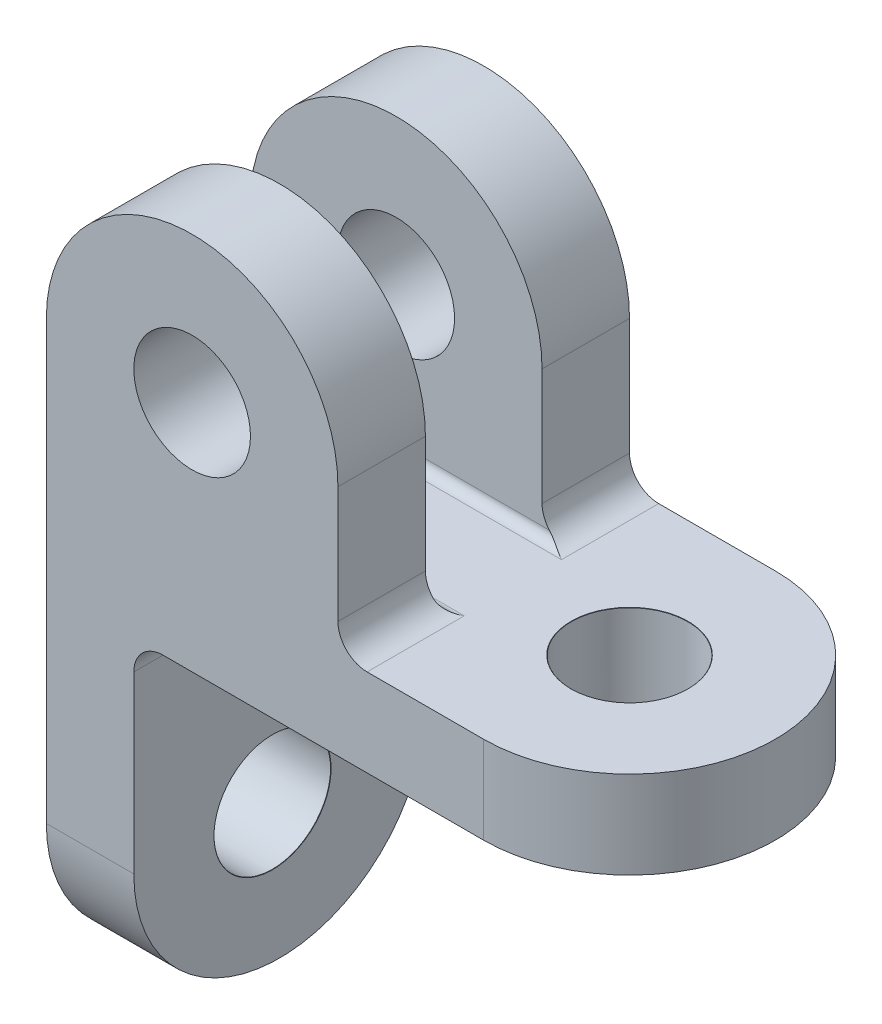
from build123d import *

# Parameters (mm, degrees)
BOSS_EXTRUDE1_DEPTH                        = 15
BOSS_EXTRUDE2_START                        = 6
SKETCH1_3_R                                = 6
BOSS_EXTRUDE2_DEPTH                        = 9
BOSS_EXTRUDE3_START                        = -15
SKETCH1_4_R                                = 6
BOSS_EXTRUDE3_DEPTH                        = 9
FILLET1_RADIUS                             = 15
FILLET1_LENGTH                             = 9
FILLET2_RADIUS                             = 15
FILLET2_LENGTH                             = 9
F_12_0MM_DOWEL_HOLE1_D                     = 12
F_12_0MM_DOWEL_HOLE1_CSINK_D               = 12.05
F_12_0MM_DOWEL_HOLE1_CSINK_ANGLE           = 90
F_12_0MM_DOWEL_HOLE1_ON_FACE_2_D           = 12
F_12_0MM_DOWEL_HOLE1_ON_FACE_2_CSINK_D     = 12.05
F_12_0MM_DOWEL_HOLE1_ON_FACE_2_CSINK_ANGLE = 90
FILLET3_R                                  = 3
FILLET4_R                                  = 3
FILLET5_R                                  = 1


with BuildPart() as part:
    # Sketch1 → Boss-Extrude1 (new, symmetric)
    with BuildSketch(Plane.XY):
        Polygon((0, 45), (0, 0), (9, 0), (9, 36), (60, 36), (60, 45), (30, 45), align=None)
    extrude(amount=BOSS_EXTRUDE1_DEPTH, both=True)

    # Sketch1<3> → Boss-Extrude2 (add)
    with BuildSketch(Plane.XY.offset(BOSS_EXTRUDE2_START)):
        with BuildLine():
            Line((0, 60), (0, 45))
            Line((0, 45), (30, 45))
            Line((30, 45), (30, 60))
            ThreePointArc((30, 60), (15, 75), (0, 60))
        make_face()
        with Locations((15, 60)):
            Circle(SKETCH1_3_R, mode=Mode.SUBTRACT)
    extrude(amount=BOSS_EXTRUDE2_DEPTH)

    # Sketch1<4> → Boss-Extrude3 (add)
    with BuildSketch(Plane.XY.offset(BOSS_EXTRUDE3_START)):
        with BuildLine():
            Line((0, 60), (0, 45))
            Line((0, 45), (30, 45))
            Line((30, 45), (30, 60))
            ThreePointArc((30, 60), (15, 75), (0, 60))
        make_face()
        with Locations((15, 60)):
            Circle(SKETCH1_4_R, mode=Mode.SUBTRACT)
    extrude(amount=BOSS_EXTRUDE3_DEPTH)

    # Fillet1: full round fillet: the end face becomes a half cylinder, R = half its width
    fillet1_face = Plane((60, 40.5, 0), x_dir=(0, -1, 0), z_dir=(1, 0, 0))  # on the end face: x along it, z out of the body
    fillet1_slab = fillet1_face.offset(-FILLET1_RADIUS / 2) * Box(FILLET1_LENGTH, 2 * FILLET1_RADIUS, FILLET1_RADIUS, mode=Mode.PRIVATE)  # the body's end, R deep
    fillet1_round = Plane((45, 40.5, 0), x_dir=(1, 0, 0), z_dir=(0, -1, 0)) * Cylinder(FILLET1_RADIUS, FILLET1_LENGTH, mode=Mode.PRIVATE)  # its axis R under the face
    add(fillet1_slab - fillet1_round, mode=Mode.SUBTRACT)

    # Fillet2: full round fillet: the end face becomes a half cylinder, R = half its width
    fillet2_face = Plane((4.5, 0, 0), x_dir=(-1, 0, 0), z_dir=(0, -1, 0))  # on the end face: x along it, z out of the body
    fillet2_slab = fillet2_face.offset(-FILLET2_RADIUS / 2) * Box(FILLET2_LENGTH, 2 * FILLET2_RADIUS, FILLET2_RADIUS, mode=Mode.PRIVATE)  # the body's end, R deep
    fillet2_round = Plane((4.5, 15, 0), x_dir=(0, -1, 0), z_dir=(-1, 0, 0)) * Cylinder(FILLET2_RADIUS, FILLET2_LENGTH, mode=Mode.PRIVATE)  # its axis R under the face
    add(fillet2_slab - fillet2_round, mode=Mode.SUBTRACT)

    # Ø12.0mm Dowel Hole1 (through all)
    with Locations(Plane(origin=(9, 14.262563745, 0.728544171), x_dir=(0, 0, 1), z_dir=(1, 0, 0))):
        with Locations((0, 0)):
            CounterSinkHole(F_12_0MM_DOWEL_HOLE1_D / 2, F_12_0MM_DOWEL_HOLE1_CSINK_D / 2, counter_sink_angle=F_12_0MM_DOWEL_HOLE1_CSINK_ANGLE)

    # Ø12.0mm Dowel Hole1 on face 2 (through all)
    with Locations(Plane(origin=(45, 45, 0), x_dir=(0, 0, 1), z_dir=(0, 1, 0))):
        with Locations((0, 0)):
            CounterSinkHole(F_12_0MM_DOWEL_HOLE1_ON_FACE_2_D / 2, F_12_0MM_DOWEL_HOLE1_ON_FACE_2_CSINK_D / 2, counter_sink_angle=F_12_0MM_DOWEL_HOLE1_ON_FACE_2_CSINK_ANGLE)

    # Fillet3
    fillet3_edges = [part.edges().sort_by_distance(p)[0] for p in [
        (9, 36, 0),
    ]]
    fillet(fillet3_edges, radius=FILLET3_R)

    # Fillet4
    fillet4_edges = [part.edges().sort_by_distance(p)[0] for p in [
        (30, 45, 10.5),
        (30, 45, -10.5),
    ]]
    fillet(fillet4_edges, radius=FILLET4_R)

    # Fillet5
    fillet5_edges = [part.edges().sort_by_distance(p)[0] for p in [
        (16.5, 45, 6),
        (16.5, 45, -6),
    ]]
    fillet(fillet5_edges, radius=FILLET5_R)


solid = part.part
